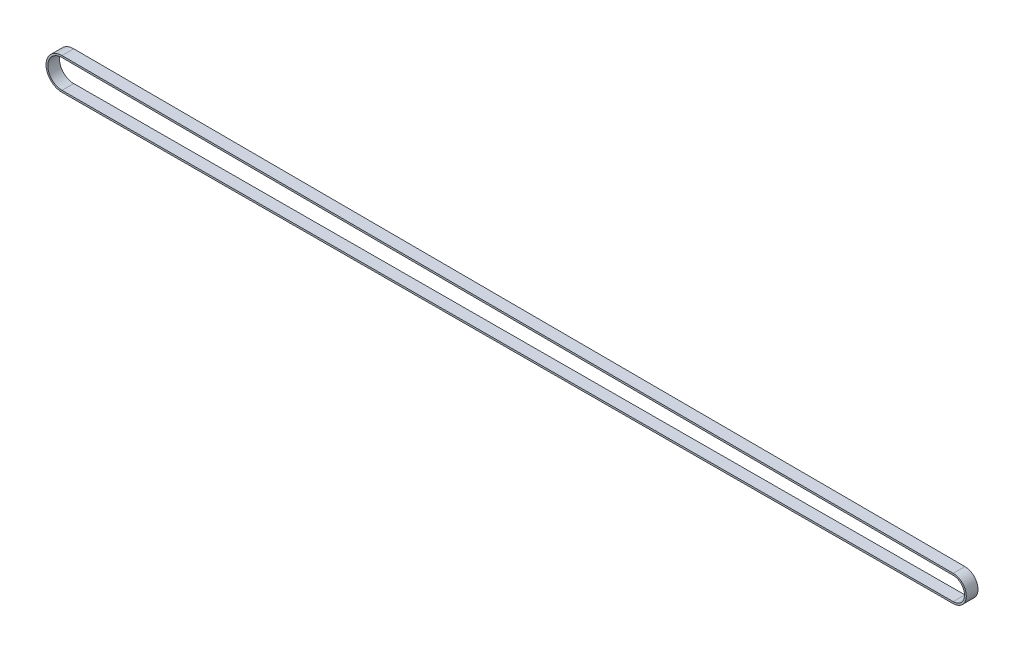
from build123d import *

# Parameters (mm, degrees)
EXTRUDE_THIN1_DEPTH = 2.5


with BuildPart() as part:
    # Sketch2 → Extrude-Thin1 (new, symmetric)
    with BuildSketch(Plane.XY):
        with BuildLine():
            Line((-380.478516689, -5.503948306), (0.017698817, -6.703942338))
            ThreePointArc((0.017698817, -6.703942338), (5.612, -12.315914429), (0.017698817, -17.927886521))
            Line((0.017698817, -17.927886521), (-380.478516689, -19.127880553))
            ThreePointArc((-380.478516689, -19.127880553), (-387.312, -12.315914429), (-380.478516689, -5.503948306))
        make_face()
        with BuildLine():
            Line((-380.480919842, -6.265944516), (0.015295664, -7.465938549))
            ThreePointArc((0.015295664, -7.465938549), (4.85, -12.315914429), (0.015295664, -17.16589031))
            Line((0.015295664, -17.16589031), (-380.480919842, -18.365884342))
            ThreePointArc((-380.480919842, -18.365884342), (-386.55, -12.315914429), (-380.480919842, -6.265944516))
        make_face(mode=Mode.SUBTRACT)
    extrude(amount=EXTRUDE_THIN1_DEPTH, both=True)


solid = part.part
